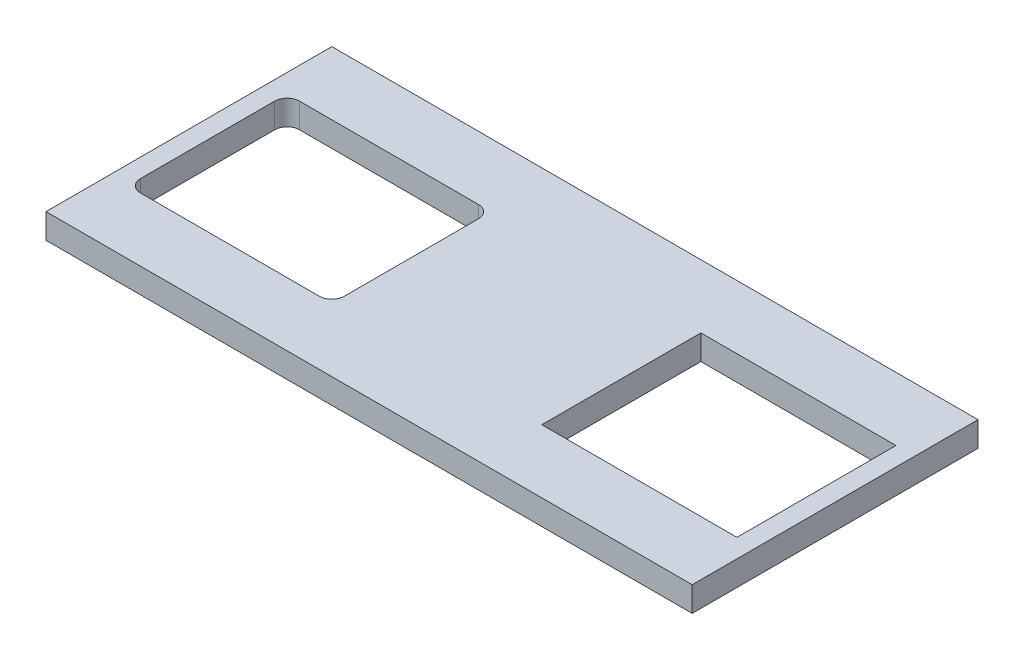
from build123d import *

# Parameters (mm, degrees)
SKETCH1_W           = 260
SKETCH1_H           = 115
SKETCH1_W_2         = 78.493115051
SKETCH1_H_2         = 64
BOSS_EXTRUDE1_DEPTH = 10


with BuildPart() as part:
    # Sketch1 → Boss-Extrude1 (new body)
    with BuildSketch(Plane(origin=(0, 0, 0), x_dir=(1, 0, 0), z_dir=(0, 1, 0))):
        with Locations((-130, 57.5)):
            Rectangle(SKETCH1_W, SKETCH1_H)
        with BuildLine():
            ThreePointArc((-247.5, 89.5), (-251.035533906, 88.035533906), (-252.5, 84.5))
            Line((-252.5, 84.5), (-252.5, 30.5))
            ThreePointArc((-252.5, 30.5), (-251.035533906, 26.964466094), (-247.5, 25.5))
            Line((-247.5, 25.5), (-175.5, 25.5))
            ThreePointArc((-175.5, 25.5), (-171.964466094, 26.964466094), (-170.5, 30.5))
            Line((-170.5, 30.5), (-170.5, 84.5))
            ThreePointArc((-170.5, 84.5), (-171.964466094, 88.035533906), (-175.5, 89.5))
            Line((-175.5, 89.5), (-247.5, 89.5))
        make_face(mode=Mode.SUBTRACT)
        with Locations((-46.746557526, 57.5)):
            Rectangle(SKETCH1_W_2, SKETCH1_H_2, mode=Mode.SUBTRACT)
    extrude(amount=BOSS_EXTRUDE1_DEPTH)


solid = part.part
